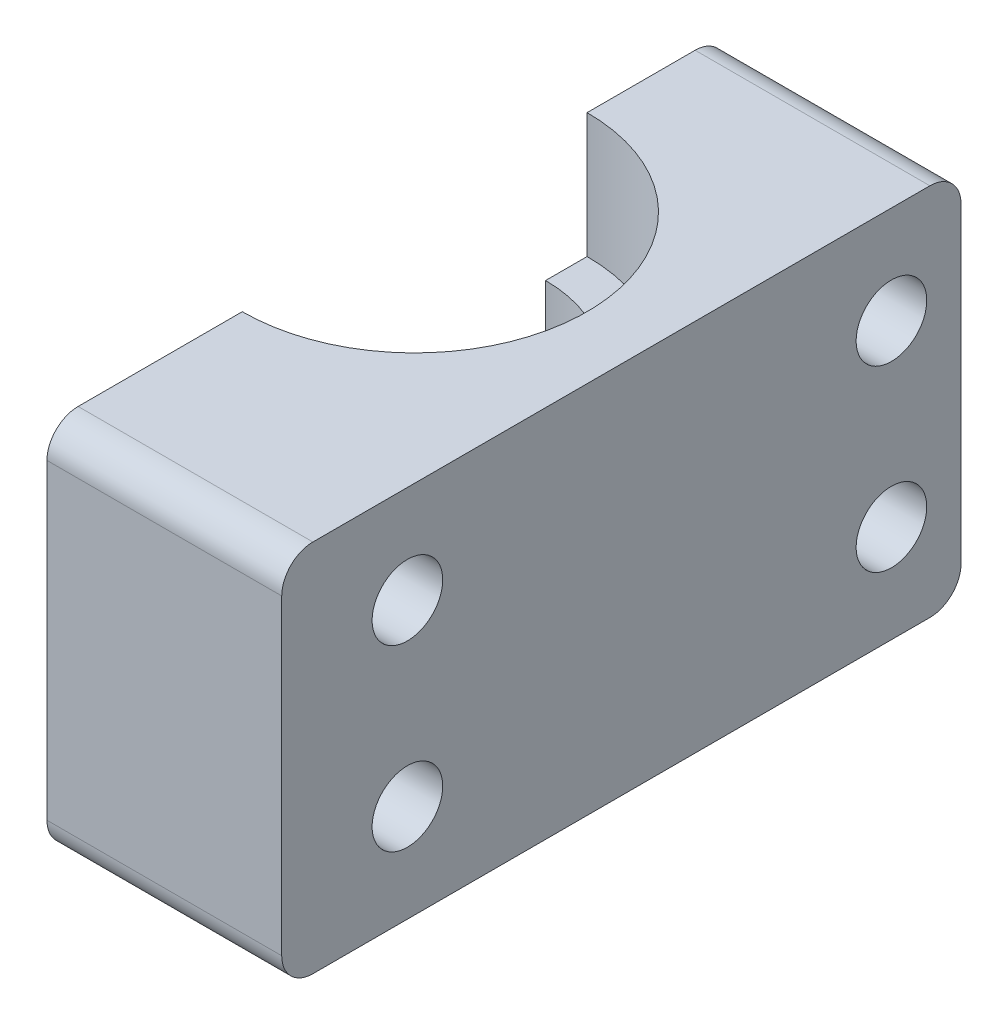
from build123d import *

# Parameters (mm, degrees)
SKETCH8_W           = 30
SKETCH8_H           = 100
BOSS_EXTRUDE1_DEPTH = 100
SKETCH9_W           = 88.7
SKETCH9_H           = 30
CUT_EXTRUDE1_DEPTH  = 103.708324882
SKETCH10_R          = 1.7
CUT_EXTRUDE2_DEPTH  = 21.825225089
MOVE_FACE1_BY       = 2.7
FILLET1_R           = 1.5


with BuildPart() as part:
    # Sketch8 → Boss-Extrude1 (new body)
    with BuildSketch(Plane(origin=(0, 0, 0), x_dir=(0, 0, -1), z_dir=(1, 0, 0))):
        Rectangle(SKETCH8_W, SKETCH8_H)
    extrude(amount=BOSS_EXTRUDE1_DEPTH)

    # Sketch7 → Cut-Revolve3 (revolve, cut)
    with BuildSketch(Plane(origin=(0, 0, 0), x_dir=(0, 0, -1), z_dir=(1, 0, 0))):
        Polygon((-8.3, 9), (-150, 9), (-150, 50), (0, 50), (0, -50), (-150, -50), (-150, -9), (-8.3, -9), (-8.3, -3), (-6.3, -3), (-6.3, 3), (-8.3, 3), align=None)
    revolve(axis=Axis((0, -50, 0), (0, 1, 0)), mode=Mode.SUBTRACT)

    # Sketch9 → Cut-Extrude1 (cut, through all)
    with BuildSketch(Plane(origin=(0, 9, 0), x_dir=(1, 0, 0), z_dir=(0, 1, 0))):
        with Locations((55.65, 0)):
            Rectangle(SKETCH9_W, SKETCH9_H)
    extrude(amount=-CUT_EXTRUDE1_DEPTH, mode=Mode.SUBTRACT)

    # Sketch10 → Cut-Extrude2 (cut, through all)
    with BuildSketch(Plane.ZY):
        with Locations((-11.65, 4.3)):
            Circle(SKETCH10_R)
        with Locations((-11.65, -4.3)):
            Circle(SKETCH10_R)
        with Locations((11.65, -4.3)):
            Circle(SKETCH10_R)
        with Locations((11.65, 4.3)):
            Circle(SKETCH10_R)
    extrude(amount=-CUT_EXTRUDE2_DEPTH, mode=Mode.SUBTRACT)

    # Move Face1: a face moved outward by 2.7
    extrude(part.faces().sort_by_distance((5.65, 0, 15))[0], amount=MOVE_FACE1_BY, dir=(0, 0, 1))

    # Fillet1
    fillet1_edges = [part.edges().sort_by_distance(p)[0] for p in [
        (5.65, 9, 17.7),
        (5.65, -9, -15),
        (5.65, -9, 17.7),
        (5.65, 9, -15),
    ]]
    fillet(fillet1_edges, radius=FILLET1_R)


solid = part.part
